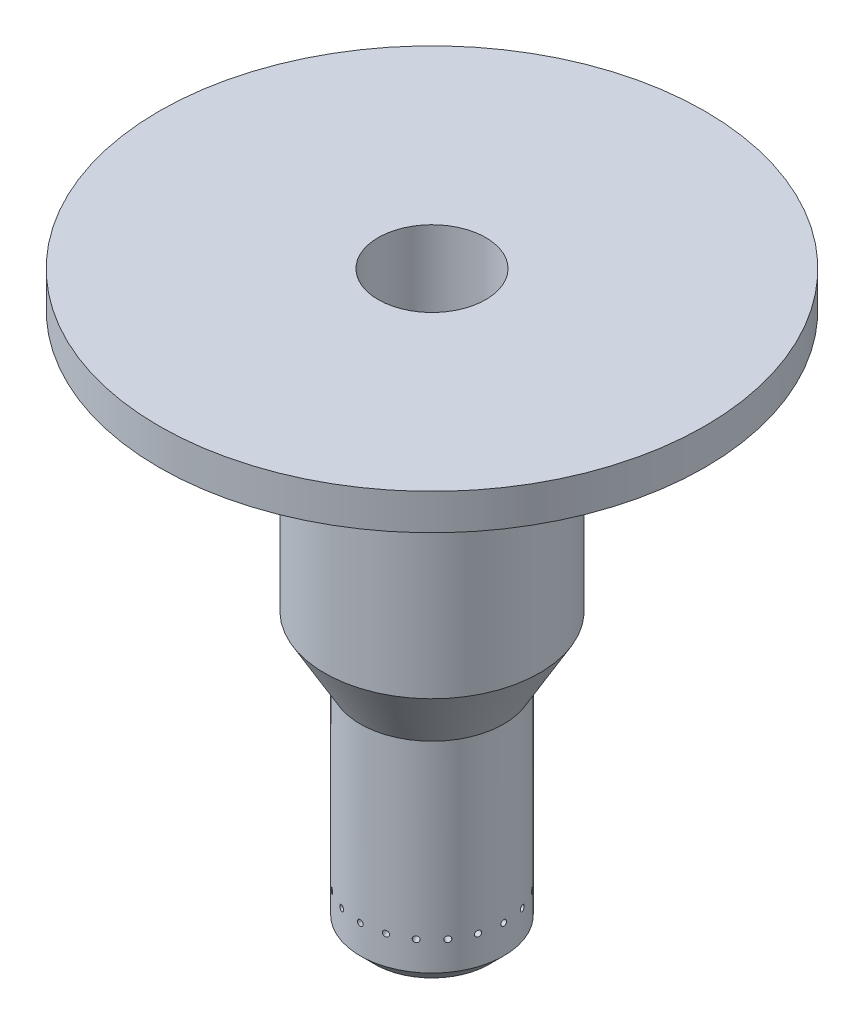
from build123d import *

# Parameters (mm, degrees)
CHAMFER1_SIZE                    = 1.27
CIRPATTERN2_COUNT                = 20
F_3_8_0_375_DIAMETER_HOLE2_D     = 9.525
F_3_8_0_375_DIAMETER_HOLE2_DEPTH = 46.99
F_3_8_0_375_DIAMETER_HOLE2_TIP   = 2.861598698


with BuildPart() as part:
    # Sketch1 → Revolve1 (revolve)
    with BuildSketch(Plane.XY, mode=Mode.PRIVATE) as revolve1_sk:
        Polygon((6.35, 0), (6.35, 19.05), (9.525, 24.549261314), (9.525, 47.625), (24.1554, 47.625), (24.1554, 50.8), (9.525, 50.8), (0, 50.8), (0, 0), align=None)
    revolve(revolve1_sk.sketch.rotate(Axis((0, 0, 0), (0, 1, 0)), 90), axis=Axis((0, 0, 0), (0, 1, 0)))

    # Chamfer1
    chamfer1_edges = [part.edges().sort_by_distance(p)[0] for p in [
        (0, 0, 6.35),
    ]]
    chamfer(chamfer1_edges, length=CHAMFER1_SIZE)

    # Sketch3 → #76 (0.02) Diameter Hole1 (revolve, cut)
    with BuildSketch(Plane(origin=(6.35, 3.81, 0), x_dir=(0, 0, -1), z_dir=(0, 1, 0))):
        Polygon((0, 0), (0, 2.692618597), (0.254, 2.54), (0.254, 0), align=None)
    f_76_0_02_diameter_hole1 = revolve(axis=Axis((12.7, 3.81, 0), (-1, 0, 0)), mode=Mode.SUBTRACT)

    # CirPattern2: #76 (0.02) Diameter Hole1 ×20 about axis
    cirpattern2_axis = Axis((0, 0, 0), (0, -1, 0))
    for i in range(1, CIRPATTERN2_COUNT):
        add(f_76_0_02_diameter_hole1.rotate(cirpattern2_axis, i * 360 / CIRPATTERN2_COUNT), mode=Mode.SUBTRACT)

    # 3/8 (0.375) Diameter Hole2
    with Locations(Plane(origin=(0, 50.8, 0), x_dir=(1, 0, 0), z_dir=(0, 1, 0))):
        with Locations((0, 0)):
            Hole(F_3_8_0_375_DIAMETER_HOLE2_D / 2, depth=F_3_8_0_375_DIAMETER_HOLE2_DEPTH)
            with Locations((0, 0, -(F_3_8_0_375_DIAMETER_HOLE2_DEPTH + F_3_8_0_375_DIAMETER_HOLE2_TIP / 2))):  # 118° drill point
                Cone(0, F_3_8_0_375_DIAMETER_HOLE2_D / 2, F_3_8_0_375_DIAMETER_HOLE2_TIP, mode=Mode.SUBTRACT)


solid = part.part
